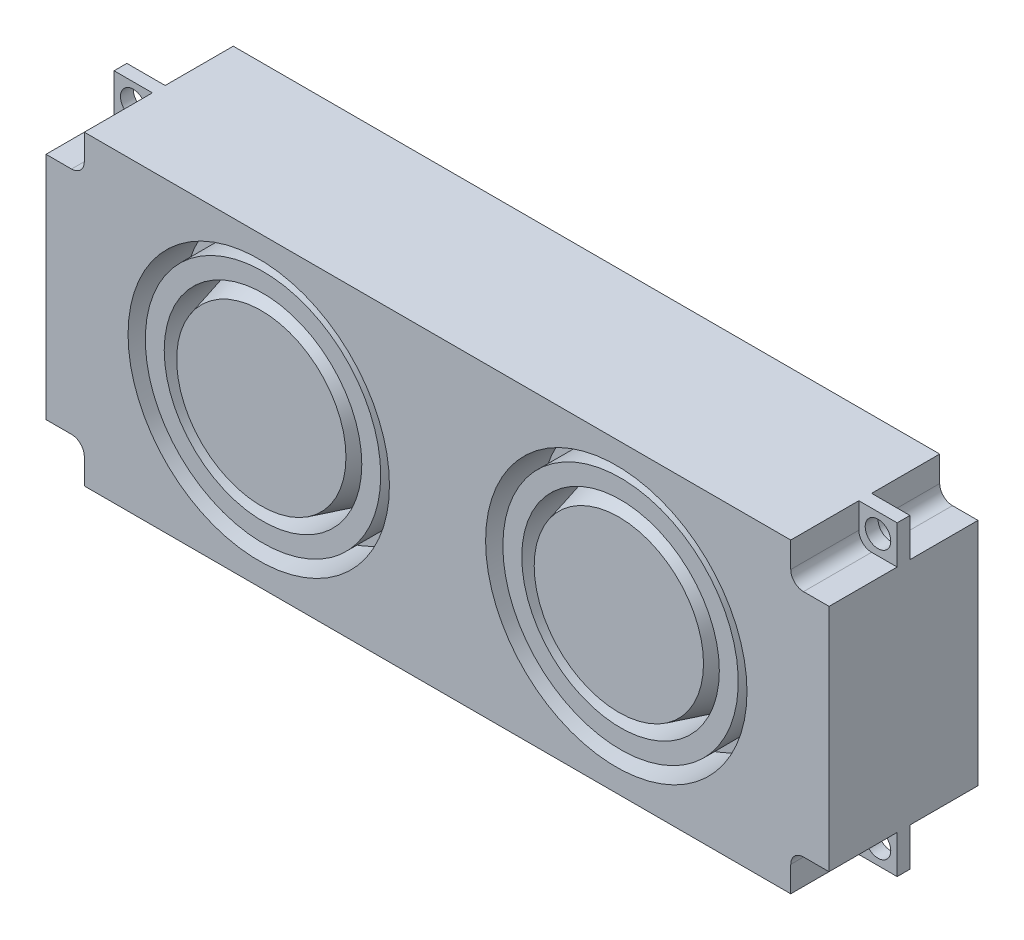
from build123d import *

# Parameters (mm, degrees)
SKETCH1_W               = 92
SKETCH1_H               = 36
BOSS_EXTRUDE1_DEPTH     = 8.75
CUT_EXTRUDE1_DEPTH      = 53.404675364
CUT_EXTRUDE1_DEPTH_BACK = 53.404675364
SKETCH2_R               = 1.5
SKETCH3_R               = 1.5
CUT_EXTRUDE2_DEPTH      = 8
CUT_EXTRUDE3_START      = -8
SKETCH4_R               = 1.5
CUT_EXTRUDE3_DEPTH      = 8
SKETCH5_R               = 15.355410725
CUT_EXTRUDE4_DEPTH      = 6.5
SKETCH6_R               = 13.829083231
SKETCH6_R_2             = 11.607285571
BOSS_EXTRUDE2_DEPTH     = 6
SKETCH7_R               = 11.607285571
BOSS_EXTRUDE3_DEPTH     = 6.2
BOSS_EXTRUDE3_TAPER     = 15


with BuildPart() as part:
    # Sketch1 → Boss-Extrude1 (new, symmetric)
    with BuildSketch(Plane.XY):
        Rectangle(SKETCH1_W, SKETCH1_H)
    extrude(amount=BOSS_EXTRUDE1_DEPTH, both=True)

    # Sketch2 → Cut-Extrude1 (cut, two sides: drawn at the far end of the back side and taken through both)
    with BuildSketch(Plane.XY.offset(8.75).offset(-CUT_EXTRUDE1_DEPTH_BACK)):
        with Locations((43.75, 15.75)):
            Circle(SKETCH2_R)
        with Locations((43.75, -15.75)):
            Circle(SKETCH2_R)
        with Locations((-43.75, -15.75)):
            Circle(SKETCH2_R)
        with Locations((-43.75, 15.75)):
            Circle(SKETCH2_R)
    extrude(amount=CUT_EXTRUDE1_DEPTH + CUT_EXTRUDE1_DEPTH_BACK, mode=Mode.SUBTRACT)

    # Sketch3 → Cut-Extrude2 (cut)
    # profile 1 of 4: a face of its own
    with BuildSketch(Plane.XY.offset(8.75)):
        with BuildLine():
            Line((-41.5, 18), (-46, 18))
            Line((-46, 18), (-46, 13.5))
            Line((-46, 13.5), (-43, 13.5))
            ThreePointArc((-43, 13.5), (-41.939339828, 13.939339828), (-41.5, 15))
            Line((-41.5, 15), (-41.5, 18))
        make_face()
        with Locations((-43.75, 15.75)):
            Circle(SKETCH3_R, mode=Mode.SUBTRACT)
    # profile 2 of 4: a face of its own
    with BuildSketch(Plane.XY.offset(8.75)):
        with BuildLine():
            Line((41.5, 18), (41.5, 15))
            ThreePointArc((41.5, 15), (41.939339828, 13.939339828), (43, 13.5))
            Line((43, 13.5), (46, 13.5))
            Line((46, 13.5), (46, 18))
            Line((46, 18), (41.5, 18))
        make_face()
        with Locations((43.75, 15.75)):
            Circle(SKETCH3_R, mode=Mode.SUBTRACT)
    # profile 3 of 4: a face of its own
    with BuildSketch(Plane.XY.offset(8.75)):
        with BuildLine():
            Line((-41.5, -18), (-41.5, -15))
            ThreePointArc((-41.5, -15), (-41.939339828, -13.939339828), (-43, -13.5))
            Line((-43, -13.5), (-46, -13.5))
            Line((-46, -13.5), (-46, -18))
            Line((-46, -18), (-41.5, -18))
        make_face()
        with Locations((-43.75, -15.75)):
            Circle(SKETCH3_R, mode=Mode.SUBTRACT)
    # profile 4 of 4: a face of its own
    with BuildSketch(Plane.XY.offset(8.75)):
        with BuildLine():
            Line((41.5, -18), (46, -18))
            Line((46, -18), (46, -13.5))
            Line((46, -13.5), (43, -13.5))
            ThreePointArc((43, -13.5), (41.939339828, -13.939339828), (41.5, -15))
            Line((41.5, -15), (41.5, -18))
        make_face()
        with Locations((43.75, -15.75)):
            Circle(SKETCH3_R, mode=Mode.SUBTRACT)
    extrude(amount=-CUT_EXTRUDE2_DEPTH, mode=Mode.SUBTRACT)

    # Sketch4 → Cut-Extrude3 (cut)
    # profile 1 of 4: a face of its own
    with BuildSketch(Plane(origin=(0, 0, -8.75), x_dir=(-1, 0, 0), z_dir=(0, 0, -1)).offset(CUT_EXTRUDE3_START)):
        with BuildLine():
            Line((46, 18), (41.5, 18))
            Line((41.5, 18), (41.5, 15))
            ThreePointArc((41.5, 15), (41.939339828, 13.939339828), (43, 13.5))
            Line((43, 13.5), (46, 13.5))
            Line((46, 13.5), (46, 18))
        make_face()
        with Locations(Location((43.75, 15.75, 0), (0, 0, 180))):
            Circle(SKETCH4_R, mode=Mode.SUBTRACT)
    # profile 2 of 4: a face of its own
    with BuildSketch(Plane(origin=(0, 0, -8.75), x_dir=(-1, 0, 0), z_dir=(0, 0, -1)).offset(CUT_EXTRUDE3_START)):
        with BuildLine():
            Line((-41.5, 15), (-41.5, 18))
            Line((-41.5, 18), (-46, 18))
            Line((-46, 18), (-46, 13.5))
            Line((-46, 13.5), (-43, 13.5))
            ThreePointArc((-43, 13.5), (-41.939339828, 13.939339828), (-41.5, 15))
        make_face()
        with Locations(Location((-43.75, 15.75, 0), (0, 0, 180))):
            Circle(SKETCH4_R, mode=Mode.SUBTRACT)
    # profile 3 of 4: a face of its own
    with BuildSketch(Plane(origin=(0, 0, -8.75), x_dir=(-1, 0, 0), z_dir=(0, 0, -1)).offset(CUT_EXTRUDE3_START)):
        with BuildLine():
            Line((41.5, -15), (41.5, -18))
            Line((41.5, -18), (46, -18))
            Line((46, -18), (46, -13.5))
            Line((46, -13.5), (43, -13.5))
            ThreePointArc((43, -13.5), (41.939339828, -13.939339828), (41.5, -15))
        make_face()
        with Locations(Location((43.75, -15.75, 0), (0, 0, 180))):
            Circle(SKETCH4_R, mode=Mode.SUBTRACT)
    # profile 4 of 4: a face of its own
    with BuildSketch(Plane(origin=(0, 0, -8.75), x_dir=(-1, 0, 0), z_dir=(0, 0, -1)).offset(CUT_EXTRUDE3_START)):
        with BuildLine():
            Line((-46, -18), (-41.5, -18))
            Line((-41.5, -18), (-41.5, -15))
            ThreePointArc((-41.5, -15), (-41.939339828, -13.939339828), (-43, -13.5))
            Line((-43, -13.5), (-46, -13.5))
            Line((-46, -13.5), (-46, -18))
        make_face()
        with Locations(Location((-43.75, -15.75, 0), (0, 0, 180))):
            Circle(SKETCH4_R, mode=Mode.SUBTRACT)
    extrude(amount=CUT_EXTRUDE3_DEPTH, mode=Mode.SUBTRACT)

    # Sketch5 → Cut-Extrude4 (cut)
    with BuildSketch(Plane.XY.offset(8.75)):
        with Locations((-21.003558343, 0)):
            Circle(SKETCH5_R)
        with Locations((21.003558343, 0)):
            Circle(SKETCH5_R)
    extrude(amount=-CUT_EXTRUDE4_DEPTH, mode=Mode.SUBTRACT)

    # Sketch6 → Boss-Extrude2 (add)
    with BuildSketch(Plane.XY.offset(2.25)):
        with Locations((-21.003558343, 0)):
            Circle(SKETCH6_R)
        with Locations((-21.003558343, 0)):
            Circle(SKETCH6_R_2, mode=Mode.SUBTRACT)
    boss_extrude2 = extrude(amount=BOSS_EXTRUDE2_DEPTH)

    # Sketch7 → Boss-Extrude3 (add)
    with BuildSketch(Plane.XY.offset(2.25)):
        with Locations((-21.003558343, 0)):
            Circle(SKETCH7_R)
    boss_extrude3 = extrude(amount=BOSS_EXTRUDE3_DEPTH, taper=BOSS_EXTRUDE3_TAPER)

    # Mirror2: Boss-Extrude2, Boss-Extrude3 across plane
    add(boss_extrude2.mirror(Plane(origin=(0, 0, 0), x_dir=(0, 0, 1), z_dir=(1, 0, 0))))
    add(boss_extrude3.mirror(Plane(origin=(0, 0, 0), x_dir=(0, 0, 1), z_dir=(1, 0, 0))))


solid = part.part
